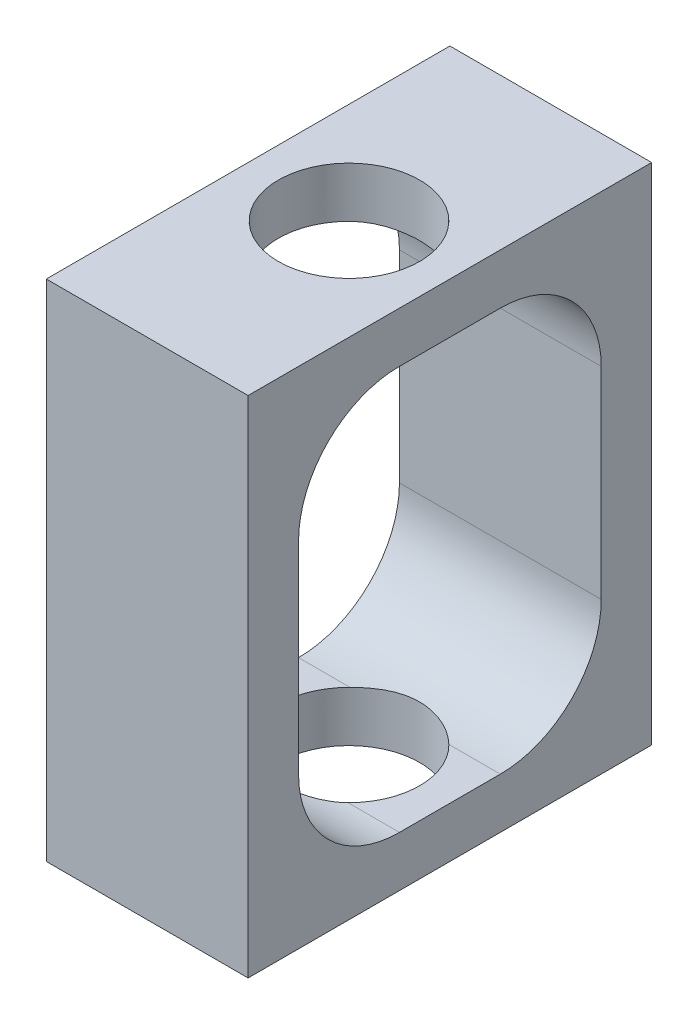
from build123d import *

# Parameters (mm, degrees)
SKETCH1_W           = 40
SKETCH1_H           = 50
BOSS_EXTRUDE1_DEPTH = 10
SKETCH3_R           = 7
CUT_EXTRUDE1_DEPTH  = 55.772255751


with BuildPart() as part:
    # Sketch1 → Boss-Extrude1 (new, symmetric)
    with BuildSketch(Plane(origin=(0, 0, 0), x_dir=(0, 0, -1), z_dir=(1, 0, 0))):
        Rectangle(SKETCH1_W, SKETCH1_H)
        with BuildLine():
            Line((-5, 20), (5, 20))
            ThreePointArc((5, 20), (12.071067812, 17.071067812), (15, 10))
            Line((15, 10), (15, -10))
            ThreePointArc((15, -10), (12.071067812, -17.071067812), (5, -20))
            Line((5, -20), (-5, -20))
            ThreePointArc((-5, -20), (-12.071067812, -17.071067812), (-15, -10))
            Line((-15, -10), (-15, 10))
            ThreePointArc((-15, 10), (-12.071067812, 17.071067812), (-5, 20))
        make_face(mode=Mode.SUBTRACT)
    extrude(amount=BOSS_EXTRUDE1_DEPTH, both=True)

    # Sketch3 → Cut-Extrude1 (cut, through all)
    with BuildSketch(Plane(origin=(0, 25, 0), x_dir=(1, 0, 0), z_dir=(0, 1, 0))):
        with Locations(Location((0, 0, 0), (0, 0, 270))):
            Circle(SKETCH3_R)
    extrude(amount=-CUT_EXTRUDE1_DEPTH, mode=Mode.SUBTRACT)


solid = part.part
